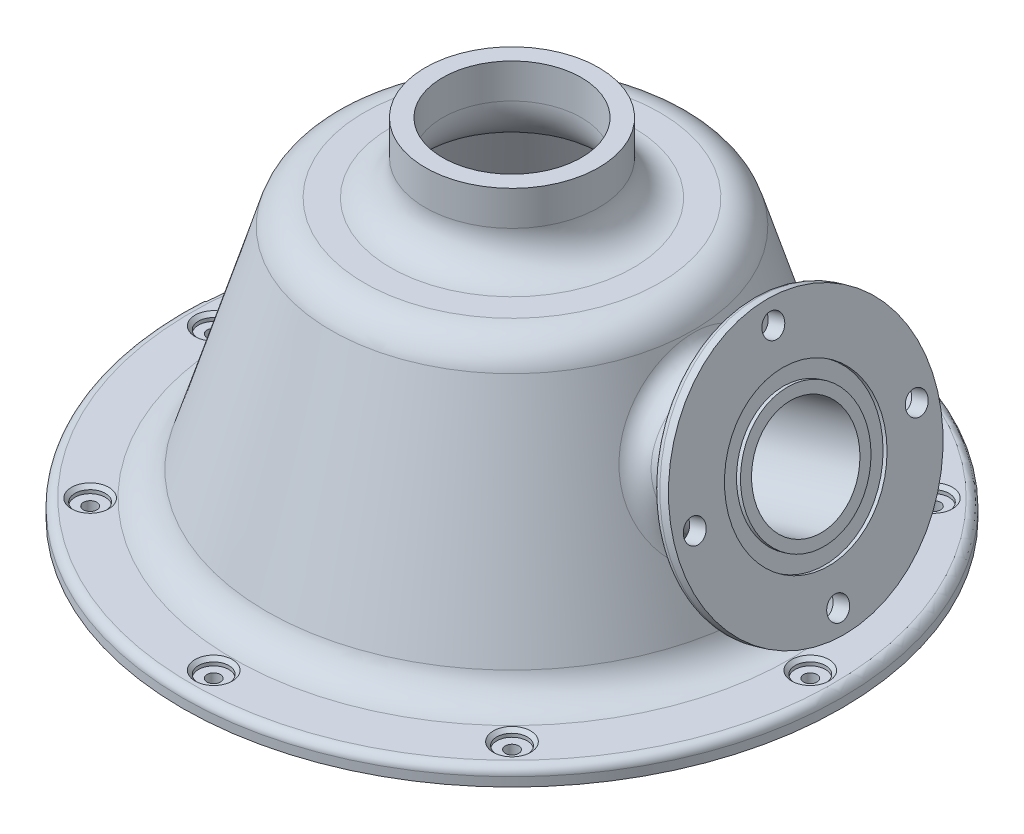
from build123d import *

# Parameters (mm, degrees)
FILLET1_R                  = 1.524
CIRPATTERN1_COUNT          = 8
FILLET2_R                  = 3.81
FILLET3_R                  = 1.524
CUT_EXTRUDE1_REACH         = 143.206
SKETCH6_R                  = 9.525
SKETCH10_R                 = 14.2875
SKETCH10_R_2               = 11.4681
CUT_EXTRUDE2_DEPTH         = 0.762
F_10_32_TAPPED_HOLE1_D     = 4.0386
F_10_32_TAPPED_HOLE1_DEPTH = 12.0396
F_10_32_TAPPED_HOLE1_TIP   = 1.213317848


with BuildPart() as part:
    # Sketch1 → Revolve1 (revolve)
    with BuildSketch(Plane.XY, mode=Mode.PRIVATE) as revolve1_sk:
        with BuildLine():
            Line((-60.325, 0), (-60.325, 3.175))
            Line((-60.325, 3.175), (-51.009176531, 3.175))
            ThreePointArc((-51.009176531, 3.175), (-47.232051835, 4.420508935), (-44.936641331, 7.668439675))
            Line((-44.936641331, 7.668439675), (-33.123782374, 46.306560325))
            ThreePointArc((-33.123782374, 46.306560325), (-30.828371869, 49.554491065), (-27.051247174, 50.8))
            Line((-27.051247174, 50.8), (-22.225, 50.8))
            ThreePointArc((-22.225, 50.8), (-17.734871939, 52.659871939), (-15.875, 57.15))
            Line((-15.875, 57.15), (-15.875, 63.5))
            Line((-15.875, 63.5), (-12.7, 63.5))
            Line((-12.7, 63.5), (-12.7, 57.15))
            ThreePointArc((-12.7, 57.15), (-15.489807909, 50.414807909), (-22.225, 47.625))
            Line((-22.225, 47.625), (-27.051247174, 47.625))
            ThreePointArc((-27.051247174, 47.625), (-28.939809522, 47.002245532), (-30.087514774, 45.378280162))
            Line((-30.087514774, 45.378280162), (-41.90037373, 6.740159513))
            ThreePointArc((-41.90037373, 6.740159513), (-45.343489487, 1.868263403), (-51.009176531, 0))
            Line((-51.009176531, 0), (-60.325, 0))
        make_face()
    revolve(revolve1_sk.sketch.rotate(Axis((0, 0, 0), (0, 1, 0)), 270), axis=Axis((0, 0, 0), (0, 1, 0)))

    # Fillet1
    fillet1_edges = [part.edges().sort_by_distance(p)[0] for p in [
        (0, 3.175, 60.325),
    ]]
    fillet(fillet1_edges, radius=FILLET1_R)

    # Sketch2 → CBORE for #2 Binding Head Machine Screw1 (revolve, cut)
    with BuildSketch(Plane(origin=(0, 3.175, -54.61), x_dir=(0, 0, 1), z_dir=(1, 0, 0))):
        Polygon((0, 0), (0, 3.175), (1.2192, 3.175), (1.2192, 1.27), (2.77876, 1.27), (2.77876, 0.635), (3.41376, 0), align=None)
    cbore_for_2_binding_head_machine_screw1 = revolve(axis=Axis((0, 9.525, -54.61), (0, -1, 0)), mode=Mode.SUBTRACT)

    # CirPattern1: CBORE for #2 Binding Head Machine Screw1 ×8 about axis
    cirpattern1_axis = Axis((0, 0, 0), (0, 1, 0))
    for i in range(1, CIRPATTERN1_COUNT):
        add(cbore_for_2_binding_head_machine_screw1.rotate(cirpattern1_axis, i * 360 / CIRPATTERN1_COUNT), mode=Mode.SUBTRACT)

    # Sketch5 → Revolve2 (revolve)
    with BuildSketch(Plane.XY, mode=Mode.PRIVATE) as revolve2_sk:
        with BuildLine():
            Line((31.63054264, 41.539442423), (43.992848292, 45.318978554))
            ThreePointArc((43.992848292, 45.318978554), (45.867926737, 46.864673943), (46.10083573, 49.283526317))
            Line((46.10083573, 49.283526317), (43.687307308, 57.177822078))
            Line((43.687307308, 57.177822078), (46.723574908, 58.10610224))
            Line((46.723574908, 58.10610224), (53.778504143, 35.030468479))
            Line((53.778504143, 35.030468479), (35.34366329, 29.394372022))
            Line((35.34366329, 29.394372022), (31.63054264, 41.539442423))
        make_face()
    revolve(revolve2_sk.sketch.rotate(Axis((0, 18.588729759, 0), (0.9563047559630353, 0.2923717047227371, 0)), 180), axis=Axis((0, 18.588729759, 0), (0.9563047559630353, 0.2923717047227371, 0)))

    # Fillet2
    fillet2_edges = [part.edges().sort_by_distance(p)[0] for p in [
        (34.32900768, 42.364445978, 0),
    ]]
    fillet(fillet2_edges, radius=FILLET2_R)

    # Fillet3
    fillet3_edges = [part.edges().sort_by_distance(p)[0] for p in [
        (43.687307308, 57.177822078, 0),
    ]]
    fillet(fillet3_edges, radius=FILLET3_R)

    # Sketch6 → Cut-Extrude1 (cut, up to next)
    with BuildSketch(Plane(origin=(58.975847026, 18.030725901, 0), x_dir=(0, 0, -1), z_dir=(0.9563047559630355, 0.29237170472273705, 0)), mode=Mode.PRIVATE) as cut_extrude1_sk1:
        with Locations(Location((0, 17.776490676, 0), (0, 0, 90))):
            Circle(SKETCH6_R)
    cut_extrude1_tool1 = extrude(cut_extrude1_sk1.sketch, amount=-CUT_EXTRUDE1_REACH, mode=Mode.PRIVATE) & part.part
    add(cut_extrude1_tool1.solids().sort_by_distance((53.778504, 35.030468, 0))[0], mode=Mode.SUBTRACT)

    # Sketch10 → Cut-Extrude2 (cut)
    with BuildSketch(Plane(origin=(58.975847026, 18.030725901, 0), x_dir=(0, 0, -1), z_dir=(0.9563047559630355, 0.2923717047227371, 0))):
        with Locations(Location((0, 17.776490676, 0), (0, 0, 90))):
            Circle(SKETCH10_R)
        with Locations(Location((0, 17.776490676, 0), (0, 0, 90))):
            Circle(SKETCH10_R_2, mode=Mode.SUBTRACT)
    extrude(amount=-CUT_EXTRUDE2_DEPTH, mode=Mode.SUBTRACT)

    # #10-32 Tapped Hole1
    with Locations(Plane(origin=(58.975847026, 18.030725901, 0), x_dir=(0, 0, -1), z_dir=(0.9563047559630355, 0.29237170472273705, 0))):
        with Locations((-20.32, 17.776490676), (0, 38.096490676), (20.32, 17.776490676), (0, -2.543509324)):
            Hole(F_10_32_TAPPED_HOLE1_D / 2, depth=F_10_32_TAPPED_HOLE1_DEPTH)
            with Locations((0, 0, -(F_10_32_TAPPED_HOLE1_DEPTH + F_10_32_TAPPED_HOLE1_TIP / 2))):  # 118° drill point
                Cone(0, F_10_32_TAPPED_HOLE1_D / 2, F_10_32_TAPPED_HOLE1_TIP, mode=Mode.SUBTRACT)


solid = part.part
